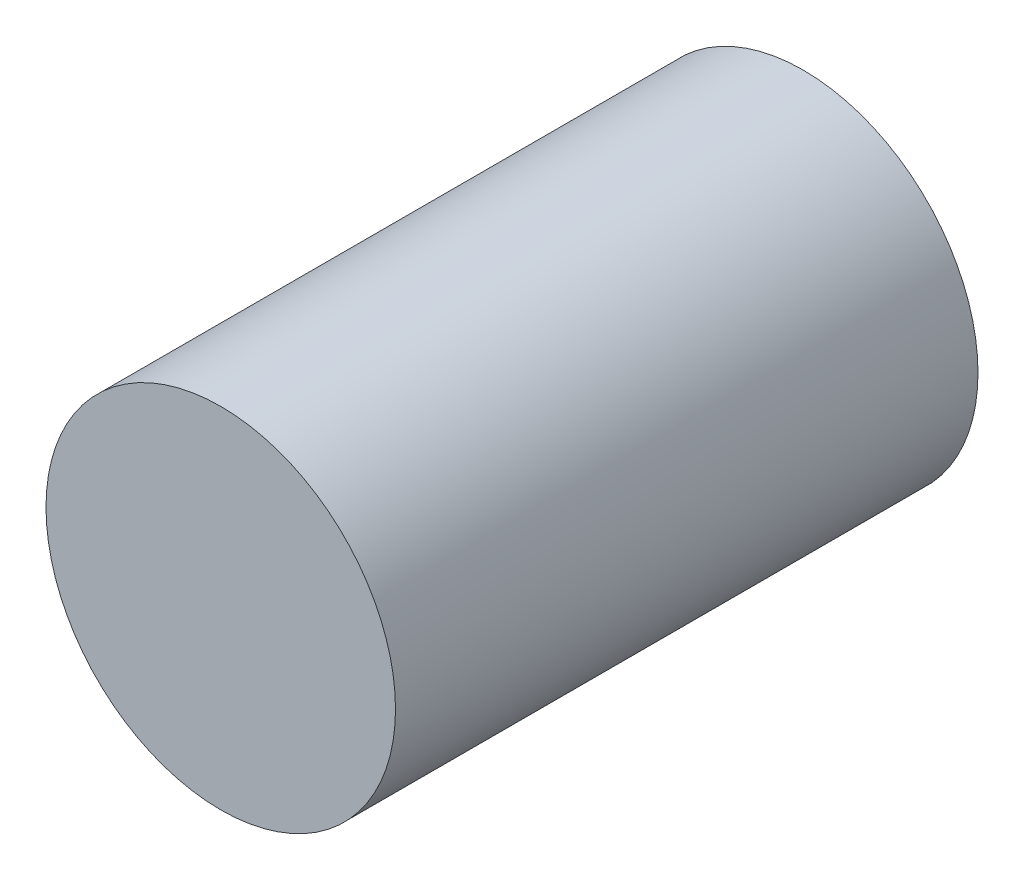
from build123d import *

# Parameters (mm, degrees)
SKETCH1_R           = 3
BOSS_EXTRUDE1_DEPTH = 10
SKETCH2_R           = 1.75
CUT_EXTRUDE1_DEPTH  = 0.5
BOSS_EXTRUDE2_START = 0.1
SKETCH3_R           = 1.75
BOSS_EXTRUDE2_DEPTH = 0.1


with BuildPart() as part:
    # Sketch1 → Boss-Extrude1 (new body)
    with BuildSketch(Plane.XY):
        Circle(SKETCH1_R)
    extrude(amount=BOSS_EXTRUDE1_DEPTH)

    # Sketch2 → Cut-Extrude1 (cut)
    with BuildSketch(Plane.XY):
        Circle(SKETCH2_R)
    extrude(amount=CUT_EXTRUDE1_DEPTH, mode=Mode.SUBTRACT)

    # Sketch3 → Boss-Extrude2 (add)
    with BuildSketch(Plane(origin=(0, 0, 0.5), x_dir=(-1, 0, 0), z_dir=(0, 0, -1)).offset(BOSS_EXTRUDE2_START)):
        Circle(SKETCH3_R)
    extrude(amount=-BOSS_EXTRUDE2_DEPTH)


solid = part.part
